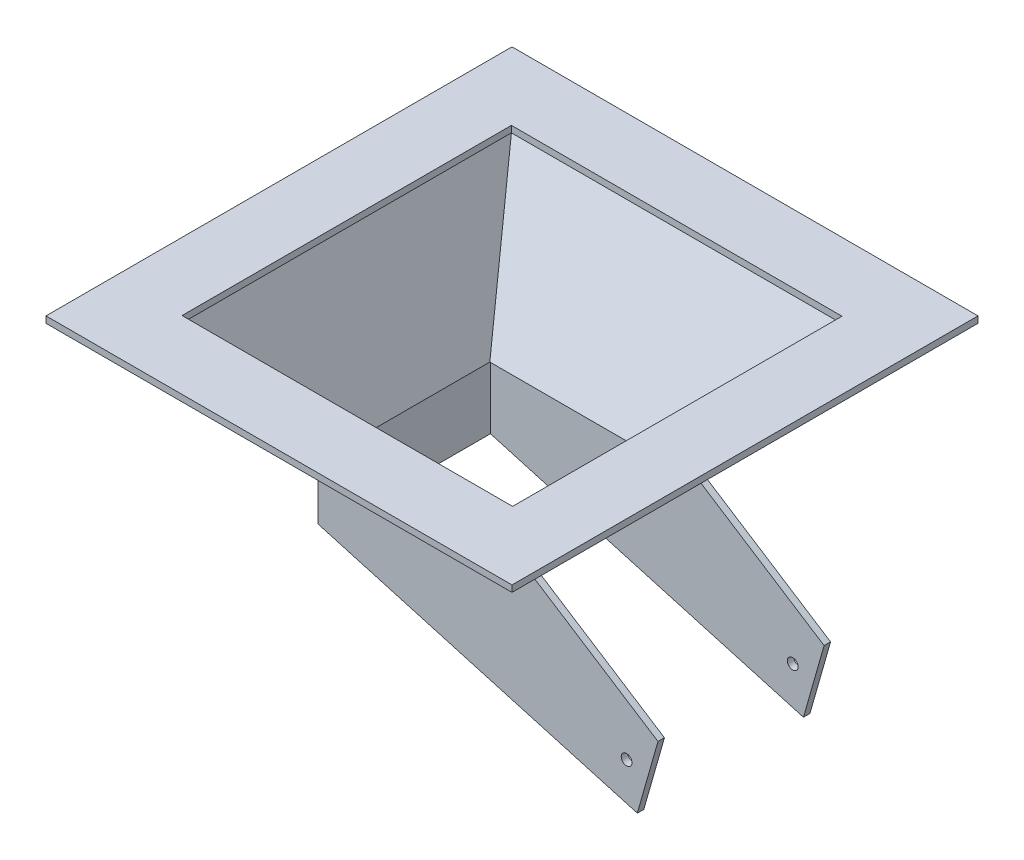
from build123d import *

# Parameters (mm, degrees)
WALL_THICKNESS_T         = -3
FLANGE_PROFILE_W         = 216
FLANGE_PROFILE_H         = 216
FLANGE_PROFILE_W_2       = 153.219712456
FLANGE_PROFILE_H_2       = 152.670025112
MOUNTING_FLANGE_DEPTH    = 3
OUTLET_START             = 37
OUTLET_SIDE_FRONT_DEPTH  = 3
OUTLET_START_2           = -37
OUTLET_SIDE_REAR_DEPTH   = 3
OUTLET_BACK_DEPTH        = 40
SKETCH_6_R               = 2.5
JOINT_FIXING_HOLES_DEPTH = 40


with BuildPart() as part:
    # 草图1 → Hopper Shape section 0
    with BuildSketch(Plane(origin=(0, 0, 0), x_dir=(1, 0, 0), z_dir=(0, 1, 0))):
        with BuildLine():
            Line((-50, -40), (50, -40))
            Line((50, -40), (50, 40))
            Line((50, 40), (-50, 40))
            Line((-50, 40), (-50, -40))
        make_face()
    # Inlet Profile → Hopper Shape section 1
    with BuildSketch(Plane(origin=(0, 57, 0), x_dir=(1, 0, 0), z_dir=(0, 1, 0))):
        with BuildLine():
            Line((-80, -80), (80, -80))
            Line((80, -80), (80, 80))
            Line((80, 80), (-80, 80))
            Line((-80, 80), (-80, -80))
        make_face()
    loft()

    # Wall Thickness
    wall_thickness_openings = [part.faces().sort_by_distance(p)[0] for p in [
        (0, 57, 0),
        (0, 0, 0),
    ]]
    offset(amount=WALL_THICKNESS_T, openings=wall_thickness_openings, kind=Kind.INTERSECTION)

    # Flange Profile → Mounting Flange (add)
    with BuildSketch(Plane(origin=(0, 57, 0), x_dir=(1, 0, 0), z_dir=(0, 1, 0))):
        Rectangle(FLANGE_PROFILE_W, FLANGE_PROFILE_H)
        Rectangle(FLANGE_PROFILE_W_2, FLANGE_PROFILE_H_2, mode=Mode.SUBTRACT)
    extrude(amount=MOUNTING_FLANGE_DEPTH)

    # 草图3 → Outlet Side Front (add)
    with BuildSketch(Plane.XY.offset(OUTLET_START)):
        Polygon((-50, 0), (50, 0), (107.665544, -37.011165), (98.094598, -70.577127), (-50, -28.475092372), align=None)
    extrude(amount=OUTLET_SIDE_FRONT_DEPTH)

    # 草图4 → Outlet Side Rear (add)
    with BuildSketch(Plane.XY.offset(OUTLET_START_2)):
        Polygon((-50, 0), (50, 0), (107.665544, -37.011165), (98.094598, -70.577127), (-50, -28.475092372), align=None)
    extrude(amount=-OUTLET_SIDE_REAR_DEPTH)

    # 草图5 → Outlet Back (add, symmetric)
    with BuildSketch(Plane.XY):
        Polygon((-50, 0), (-47, 0), (-47, -29.327967372), (-50, -28.475092372), align=None)
    extrude(amount=OUTLET_BACK_DEPTH, both=True)

    # 草图6 → Joint Fixing Holes (cut, symmetric)
    with BuildSketch(Plane.XY):
        with Locations((93.124497189, -51.590532135)):
            Circle(SKETCH_6_R)
    extrude(amount=JOINT_FIXING_HOLES_DEPTH, both=True, mode=Mode.SUBTRACT)


solid = part.part
